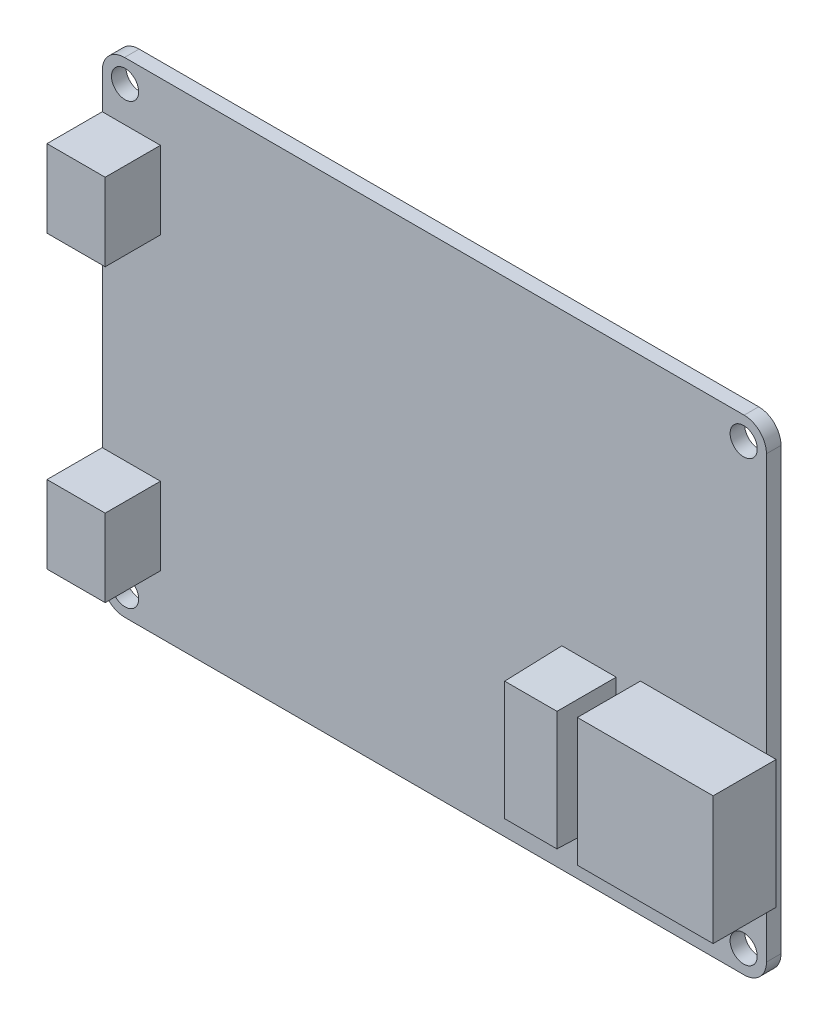
from build123d import *

# Parameters (mm, degrees)
SKETCH_1_R      = 1.4
EXTRUDE_1_DEPTH = 1.5
SKETCH_2_W      = 14
SKETCH_2_H      = 13.2
EXTRUDE_2_DEPTH = 6.5
SKETCH_3_W      = 5.6
SKETCH_3_H      = 12.5
EXTRUDE_3_DEPTH = 6
EXTRUDE_3_TAPER = 1
SKETCH_4_W      = 6
SKETCH_4_H      = 8
EXTRUDE_4_DEPTH = 5.7


with BuildPart() as part:
    # 草圖1 → 填料-伸長1 (new body)
    with BuildSketch(Plane.XY):
        with BuildLine():
            Line((25.889258578, 80.943460251), (89.789258578, 80.943460251))
            ThreePointArc((89.789258578, 80.943460251), (91.415604175, 80.269805848), (92.089258578, 78.643460251))
            Line((92.089258578, 78.643460251), (92.089258578, 33.243460251))
            ThreePointArc((92.089258578, 33.243460251), (91.415604175, 31.617114655), (89.789258578, 30.943460251))
            Line((89.789258578, 30.943460251), (25.889258578, 30.943460251))
            ThreePointArc((25.889258578, 30.943460251), (24.262912981, 31.617114655), (23.589258578, 33.243460251))
            Line((23.589258578, 33.243460251), (23.589258578, 78.643460251))
            ThreePointArc((23.589258578, 78.643460251), (24.262912981, 80.269805848), (25.889258578, 80.943460251))
        make_face()
        with Locations((25.939258578, 78.593460251)):
            Circle(SKETCH_1_R, mode=Mode.SUBTRACT)
        with Locations((25.939258578, 33.293460251)):
            Circle(SKETCH_1_R, mode=Mode.SUBTRACT)
        with Locations((89.739258578, 33.293460251)):
            Circle(SKETCH_1_R, mode=Mode.SUBTRACT)
        with Locations((89.739258578, 78.593460251)):
            Circle(SKETCH_1_R, mode=Mode.SUBTRACT)
    extrude(amount=EXTRUDE_1_DEPTH)

    # 草圖2 → 填料-伸長2 (add)
    with BuildSketch(Plane.XY.offset(1.5)):
        with Locations((86.089258578, 45.243460251)):
            Rectangle(SKETCH_2_W, SKETCH_2_H)
    extrude(amount=EXTRUDE_2_DEPTH)

    # 草圖3 → 填料-伸長3 (add)
    with BuildSketch(Plane.XY.offset(1.5)):
        with Locations((73.789258578, 44.693460251)):
            Rectangle(SKETCH_3_W, SKETCH_3_H)
    extrude(amount=EXTRUDE_3_DEPTH, taper=EXTRUDE_3_TAPER)

    # 草圖4 → 填料-伸長4 (add)
    with BuildSketch(Plane.XY.offset(1.5)):
        with Locations((26.589258578, 70.943460251)):
            Rectangle(SKETCH_4_W, SKETCH_4_H)
        with Locations((26.589258578, 40.943460251)):
            Rectangle(SKETCH_4_W, SKETCH_4_H)
    extrude(amount=EXTRUDE_4_DEPTH)


solid = part.part
